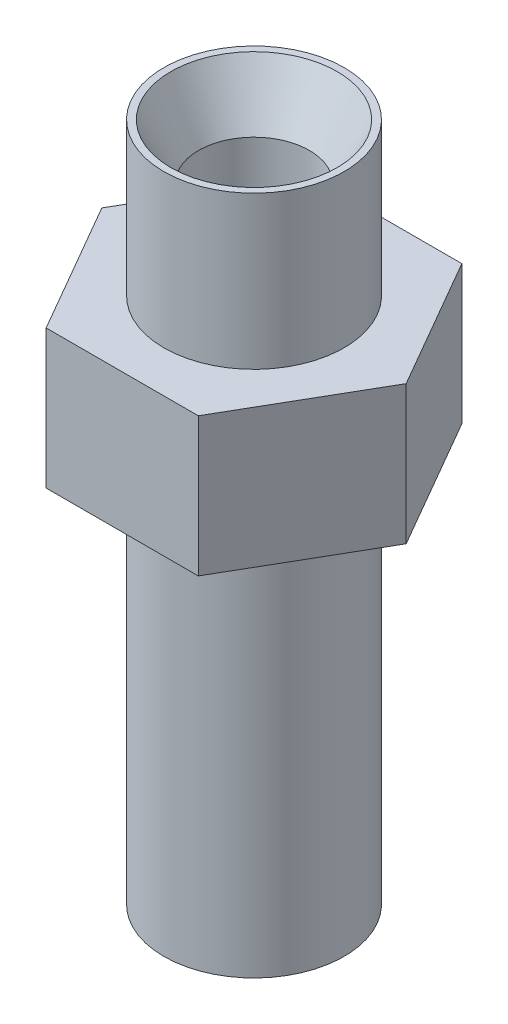
from build123d import *

# Parameters (mm, degrees)
BOSS_EXTRUDE1_DEPTH      = 10
BOSS_EXTRUDE2_DEPTH      = 11
BOSS_EXTRUDE2_DEPTH_BACK = 38
SKETCH2_R                = 6.5
SKETCH3_R                = 4
CUT_EXTRUDE1_DEPTH       = 57
CHAMFER1_SIZE            = 2
CHAMFER1_SIZE2           = 3.925221011
CHAMFER2_SIZE            = 2
CHAMFER2_SIZE2           = 1.562571253


with BuildPart() as part:
    # Sketch1 → Boss-Extrude1 (new body)
    with BuildSketch(Plane(origin=(0, 0, 0), x_dir=(1, 0, 0), z_dir=(0, 1, 0))):
        Polygon((10.969655115, 0), (5.484827557, 9.5), (-5.484827557, 9.5), (-10.969655115, 0), (-5.484827557, -9.5), (5.484827557, -9.5), align=None)
    extrude(amount=BOSS_EXTRUDE1_DEPTH)

    # Sketch2 → Boss-Extrude2 (add, two sides: drawn at the far end of the back side and taken through both)
    with BuildSketch(Plane(origin=(0, 10, 0), x_dir=(1, 0, 0), z_dir=(0, 1, 0)).offset(-BOSS_EXTRUDE2_DEPTH_BACK)):
        with Locations(Location((0, 0, 0), (0, 0, 270))):
            Circle(SKETCH2_R)
    extrude(amount=BOSS_EXTRUDE2_DEPTH + BOSS_EXTRUDE2_DEPTH_BACK)

    # Sketch3 → Cut-Extrude1 (cut)
    with BuildSketch(Plane(origin=(0, 21, 0), x_dir=(1, 0, 0), z_dir=(0, 1, 0))):
        with Locations(Location((0, 0, 0), (0, 0, 270))):
            Circle(SKETCH3_R)
    extrude(amount=-CUT_EXTRUDE1_DEPTH, mode=Mode.SUBTRACT)

    # Chamfer1
    chamfer1_edges = [part.edges().sort_by_distance(p)[0] for p in [
        (0, 21, -4),
    ]]
    chamfer1_side = [part.faces().sort_by_distance(p)[0] for p in [
        (0, 21, -6.316152237),
    ]]
    chamfer(chamfer1_edges, length=CHAMFER1_SIZE, length2=CHAMFER1_SIZE2, reference=chamfer1_side[0])

    # Chamfer2
    chamfer2_edges = [part.edges().sort_by_distance(p)[0] for p in [
        (0, -28, -4),
    ]]
    chamfer2_side = [part.faces().sort_by_distance(p)[0] for p in [
        (0, -5.462610506, -4),
    ]]
    chamfer(chamfer2_edges, length=CHAMFER2_SIZE, length2=CHAMFER2_SIZE2, reference=chamfer2_side[0])


solid = part.part
